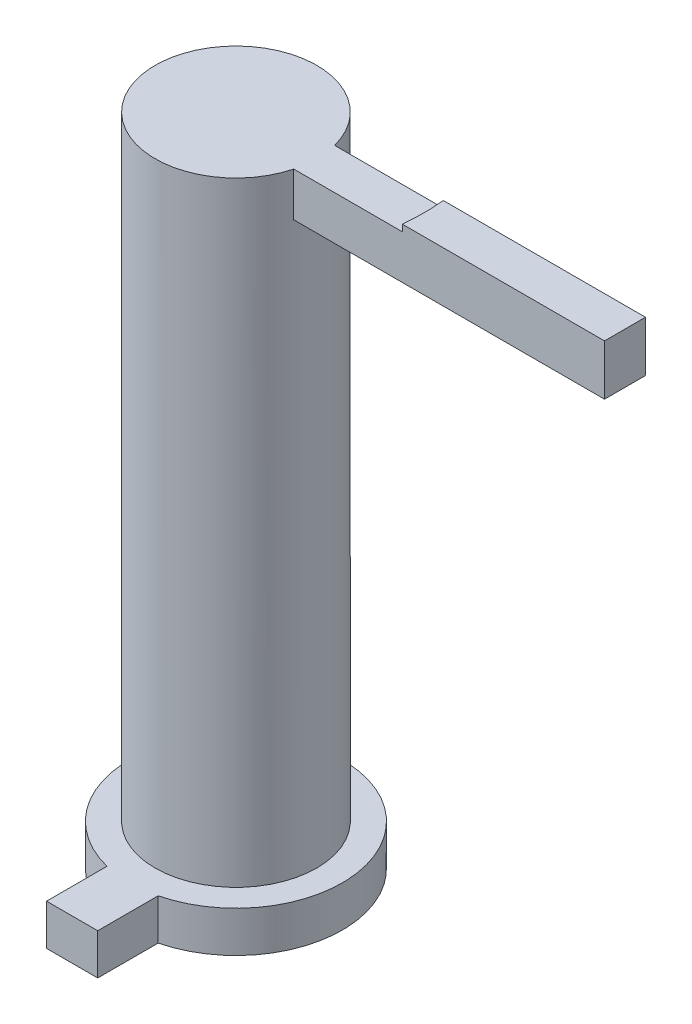
from build123d import *

# Parameters (mm, degrees)
SKETCH1_R           = 3.95
BOSS_EXTRUDE1_DEPTH = 30
SKETCH2_R           = 5.2
BOSS_EXTRUDE2_DEPTH = 2
SKETCH5_W           = 2
SKETCH5_H           = 2.467717667
BOSS_EXTRUDE3_DEPTH = 19
SKETCH6_R           = 9.177685327
CUT_EXTRUDE1_DEPTH  = 0.321276311
SKETCH8_W           = 2.5
SKETCH8_H           = 2
BOSS_EXTRUDE4_DEPTH = 8


with BuildPart() as part:
    # Sketch1 → Boss-Extrude1 (new body)
    with BuildSketch(Plane(origin=(0, 0, 0), x_dir=(1, 0, 0), z_dir=(0, 1, 0))):
        with Locations(Location((0, 0, 0), (0, 0, 270))):
            Circle(SKETCH1_R)
    extrude(amount=BOSS_EXTRUDE1_DEPTH)

    # Sketch2 → Boss-Extrude2 (add)
    with BuildSketch(Plane.XZ):
        with Locations(Location((0, 0, 0), (0, 0, 270))):
            Circle(SKETCH2_R)
    extrude(amount=BOSS_EXTRUDE2_DEPTH)

    # Sketch5 → Boss-Extrude3 (add)
    with BuildSketch(Plane(origin=(0, 0, 0), x_dir=(0, 0, -1), z_dir=(1, 0, 0))):
        with Locations((0, 29.087417478)):
            Rectangle(SKETCH5_W, SKETCH5_H)
    extrude(amount=BOSS_EXTRUDE3_DEPTH)

    # Sketch6 → Cut-Extrude1 (cut)
    with BuildSketch(Plane(origin=(0, 30, 0), x_dir=(1, 0, 0), z_dir=(0, 1, 0))):
        Circle(SKETCH6_R)
    extrude(amount=CUT_EXTRUDE1_DEPTH, mode=Mode.SUBTRACT)

    # Sketch8 → Boss-Extrude4 (add)
    with BuildSketch(Plane.XY):
        with Locations((0, -1)):
            Rectangle(SKETCH8_W, SKETCH8_H)
    extrude(amount=BOSS_EXTRUDE4_DEPTH)


solid = part.part
